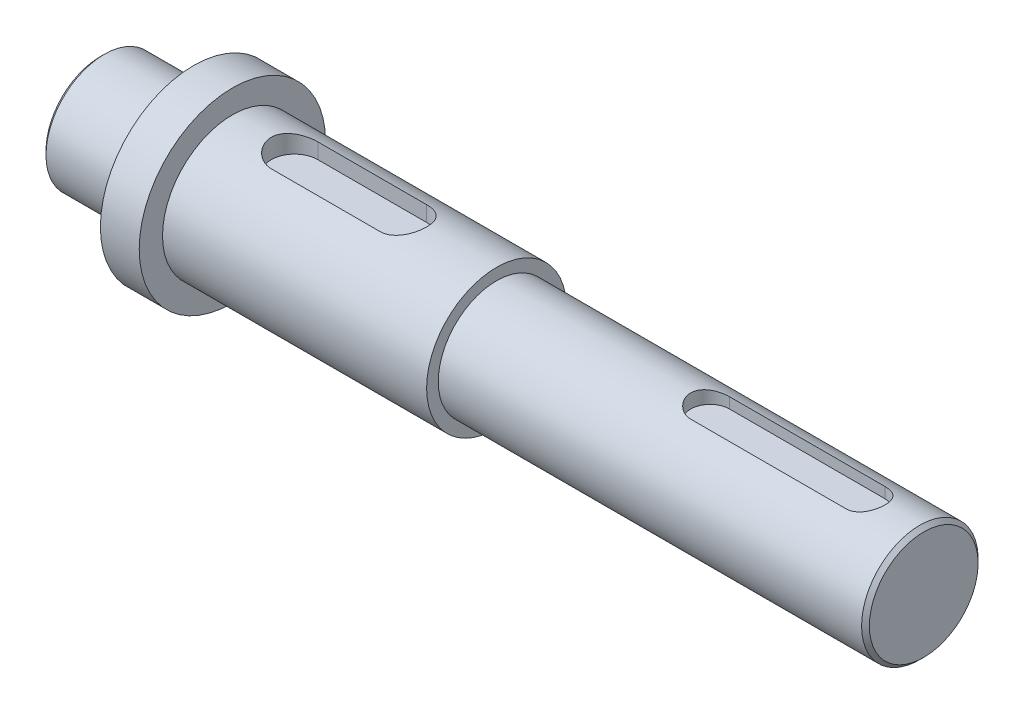
from build123d import *

# Parameters (mm, degrees)
CUT_EXTRUDE1_DEPTH = 2.5
CUT_EXTRUDE2_DEPTH = 1.8
CHAMFER1_SIZE      = 0.5


with BuildPart() as part:
    # Sketch1 → Revolve1 (revolve)
    with BuildSketch(Plane.XY, mode=Mode.PRIVATE) as revolve1_sk:
        Polygon((-69.191650854, 0), (-69.191650854, 7.5), (-57.191650854, 7.5), (-57.191650854, 12), (-52.191650854, 12), (-52.191650854, 9), (-18.191650854, 9), (-18.191650854, 7.5), (36.808349146, 7.5), (36.808349146, 0), align=None)
    revolve(revolve1_sk.sketch.rotate(Axis((-89.707779886, 0, 0), (1, 0, 0)), 90), axis=Axis((-89.707779886, 0, 0), (1, 0, 0)))

    # Sketch2 → Cut-Extrude1 (cut)
    with BuildSketch(Plane(origin=(0, 9, 0), x_dir=(1, 0, 0), z_dir=(0, 1, 0))):
        with BuildLine():
            Line((-44.191650854, 3), (-30.191650854, 3))
            ThreePointArc((-30.191650854, 3), (-27.191650854, 0), (-30.191650854, -3))
            Line((-30.191650854, -3), (-44.191650854, -3))
            ThreePointArc((-44.191650854, -3), (-47.191650854, 0), (-44.191650854, 3))
        make_face()
    extrude(amount=-CUT_EXTRUDE1_DEPTH, mode=Mode.SUBTRACT)

    # Sketch3 → Cut-Extrude2 (cut)
    with BuildSketch(Plane(origin=(0, 7.5, 0), x_dir=(1, 0, 0), z_dir=(0, 1, 0))):
        with BuildLine():
            Line((9.308349146, 2.5), (29.308349146, 2.5))
            ThreePointArc((29.308349146, 2.5), (31.808349146, 0), (29.308349146, -2.5))
            Line((29.308349146, -2.5), (9.308349146, -2.5))
            ThreePointArc((9.308349146, -2.5), (6.808349146, 0), (9.308349146, 2.5))
        make_face()
    extrude(amount=-CUT_EXTRUDE2_DEPTH, mode=Mode.SUBTRACT)

    # Chamfer1
    chamfer1_edges = [part.edges().sort_by_distance(p)[0] for p in [
        (-69.191650854, 0, -7.5),
        (36.808349146, 0, -7.5),
    ]]
    chamfer(chamfer1_edges, length=CHAMFER1_SIZE)


solid = part.part
